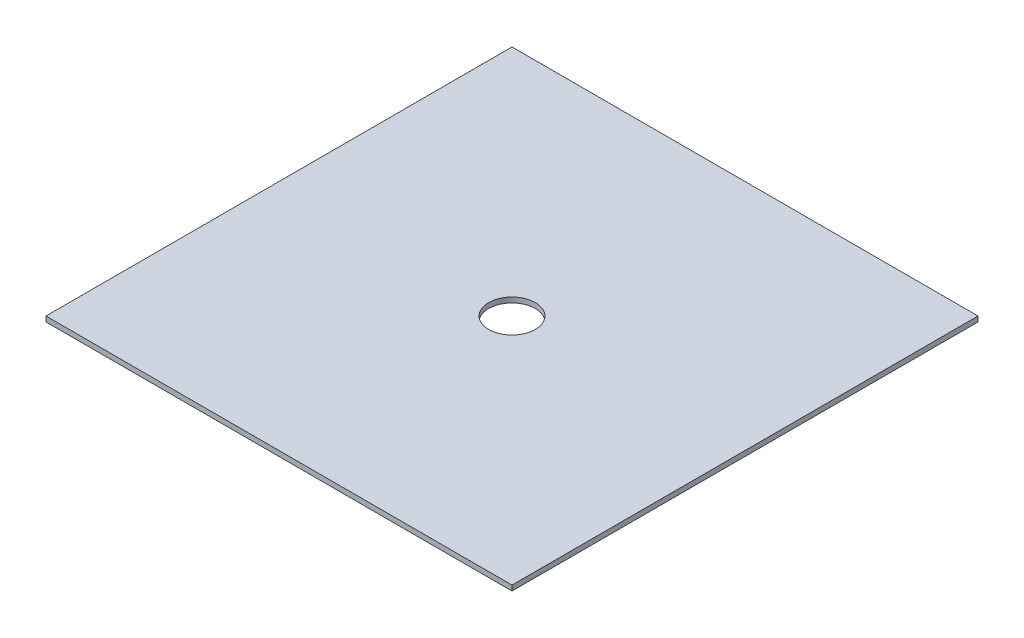
from build123d import *

# Parameters (mm, degrees)
SKETCH1_W           = 571.5
SKETCH1_H           = 571.5
SKETCH1_R           = 28.575
BOSS_EXTRUDE1_DEPTH = 6.35


with BuildPart() as part:
    # Sketch1 → Boss-Extrude1 (new body)
    with BuildSketch(Plane(origin=(0, 0, 0), x_dir=(1, 0, 0), z_dir=(0, 1, 0))):
        Rectangle(SKETCH1_W, SKETCH1_H)
        with Locations(Location((0, 0, 0), (0, 0, 270))):
            Circle(SKETCH1_R, mode=Mode.SUBTRACT)
    extrude(amount=BOSS_EXTRUDE1_DEPTH)


solid = part.part
